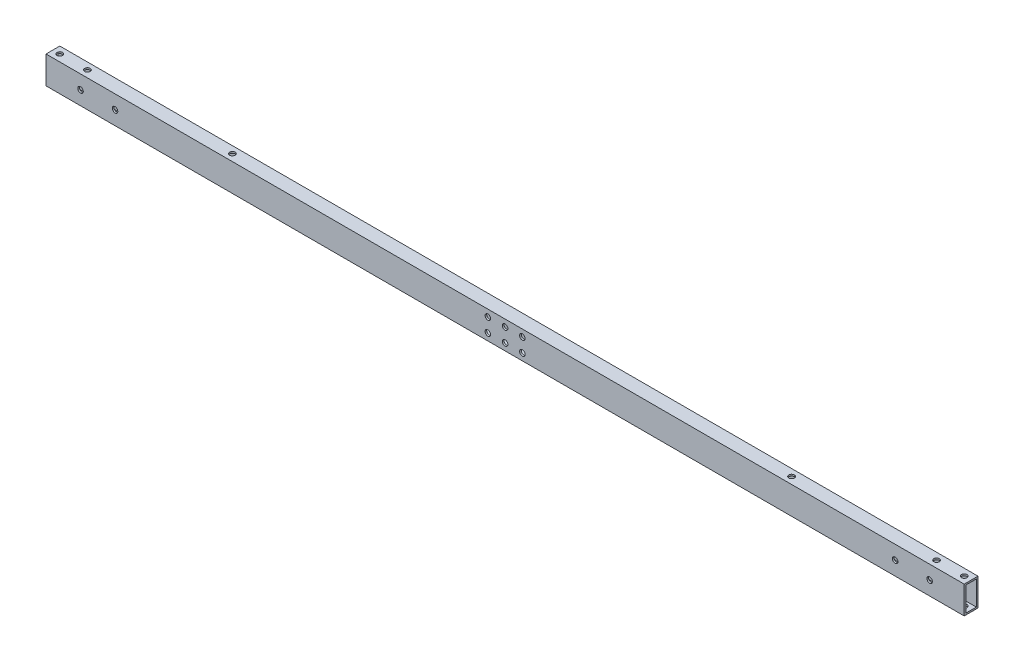
from build123d import *

# Parameters (mm, degrees)
SKETCH_1_W          = 10
SKETCH_1_H          = 20
SKETCH_1_W_2        = 7.6
SKETCH_1_H_2        = 17.6
EXTRUDE_1_DEPTH     = 665
SKETCH_2_R          = 2
CUT_EXTRUDE_1_DEPTH = 666.150358941
SKETCH_3_R          = 2
CUT_EXTRUDE_2_DEPTH = 666.319472134


with BuildPart() as part:
    # ｽｹｯﾁ1 → 押し出し-薄板1 (new body)
    with BuildSketch(Plane(origin=(0, 0, 0), x_dir=(0, 0, -1), z_dir=(1, 0, 0))):
        Rectangle(SKETCH_1_W, SKETCH_1_H)
        Rectangle(SKETCH_1_W_2, SKETCH_1_H_2, mode=Mode.SUBTRACT)
    extrude(amount=EXTRUDE_1_DEPTH)

    # ｽｹｯﾁ2 → ｶｯﾄ - 押し出し1 (cut, through all)
    with BuildSketch(Plane.XY.offset(5)):
        with Locations((25, 0)):
            Circle(SKETCH_2_R)
        with Locations(Location((640, 0, 0), (0, 0, 90))):
            Circle(SKETCH_2_R)
        with Locations((50, 0)):
            Circle(SKETCH_2_R)
        with Locations(Location((615, 0, 0), (0, 0, 90))):
            Circle(SKETCH_2_R)
        with Locations((320, 5)):
            Circle(SKETCH_2_R)
        with Locations((320, -5)):
            Circle(SKETCH_2_R)
        with Locations(Location((345, -5, 0), (0, 0, 90))):
            Circle(SKETCH_2_R)
        with Locations(Location((345, 5, 0), (0, 0, 90))):
            Circle(SKETCH_2_R)
        with Locations((332.5, 5)):
            Circle(SKETCH_2_R)
        with Locations(Location((332.5, -5, 0), (0, 0, 90))):
            Circle(SKETCH_2_R)
    extrude(amount=-CUT_EXTRUDE_1_DEPTH, mode=Mode.SUBTRACT)

    # ｽｹｯﾁ3 → ｶｯﾄ - 押し出し2 (cut, through all)
    with BuildSketch(Plane(origin=(0, 10, 0), x_dir=(1, 0, 0), z_dir=(0, 1, 0))):
        with Locations(Location((5, 0, 0), (0, 0, 270))):
            Circle(SKETCH_3_R)
        with Locations(Location((130, 0, 0), (0, 0, 270))):
            Circle(SKETCH_3_R)
        with Locations(Location((535, 0, 0), (0, 0, 270))):
            Circle(SKETCH_3_R)
        with Locations(Location((660, 0, 0), (0, 0, 270))):
            Circle(SKETCH_3_R)
        with Locations(Location((25, 0, 0), (0, 0, 270))):
            Circle(SKETCH_3_R)
        with Locations(Location((640, 0, 0), (0, 0, 270))):
            Circle(SKETCH_3_R)
    extrude(amount=-CUT_EXTRUDE_2_DEPTH, mode=Mode.SUBTRACT)


solid = part.part
